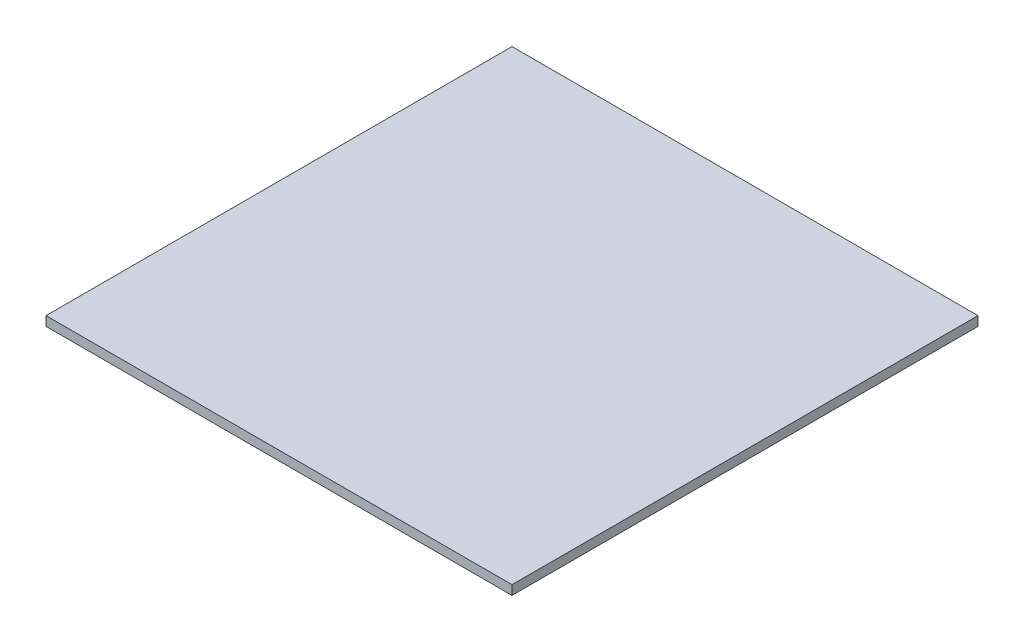
from build123d import *

# Parameters (mm, degrees)
SKETCH1_W           = 500
SKETCH1_H           = 500
BOSS_EXTRUDE1_DEPTH = 10


with BuildPart() as part:
    # Sketch1 → Boss-Extrude1 (new body)
    with BuildSketch(Plane(origin=(0, 0, 0), x_dir=(1, 0, 0), z_dir=(0, 1, 0))):
        Rectangle(SKETCH1_W, SKETCH1_H)
    extrude(amount=BOSS_EXTRUDE1_DEPTH)


solid = part.part
